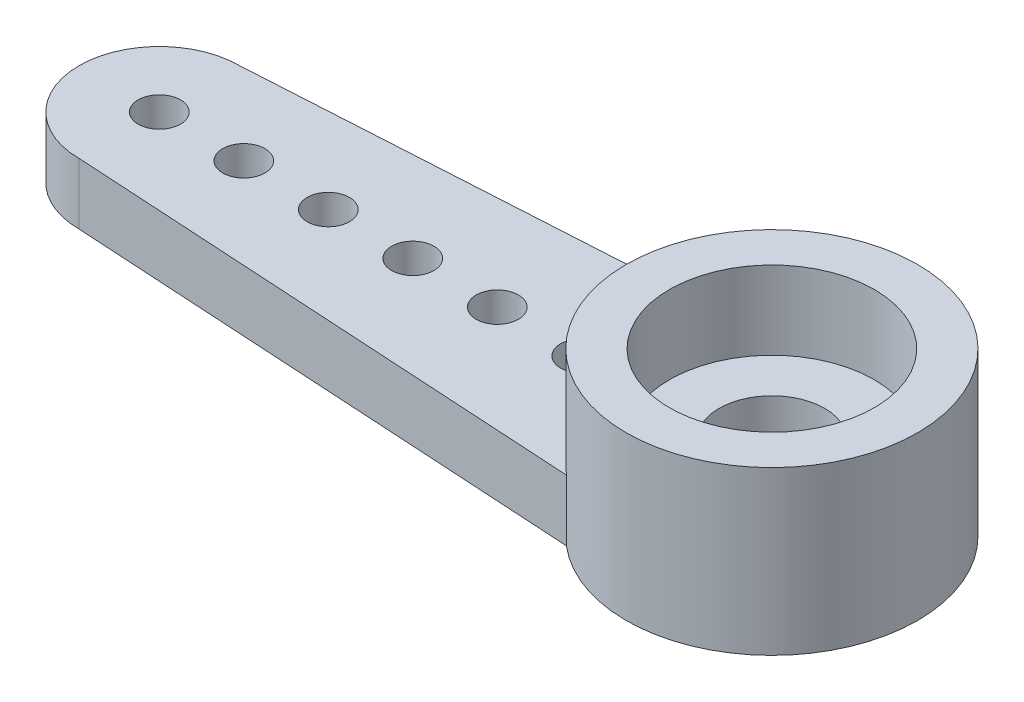
from build123d import *

# Parameters (mm, degrees)
SKETCH_1_R      = 3.45
SKETCH_1_R_2    = 2.425
EXTRUDE_1_DEPTH = 3.85
SKETCH_2_R      = 2.425
SKETCH_2_R_2    = 1.25
EXTRUDE_2_DEPTH = 1
SKETCH_3_R      = 0.5
EXTRUDE_3_DEPTH = 1.45


with BuildPart() as part:
    # 草图1 → 凸台-拉伸1 (new body)
    with BuildSketch(Plane(origin=(0, 0, 0), x_dir=(1, 0, 0), z_dir=(0, 1, 0))):
        with Locations(Location((0, 0, 0), (0, 0, 90))):
            Circle(SKETCH_1_R)
        with Locations(Location((0, 0, 0), (0, 0, 90))):
            Circle(SKETCH_1_R_2, mode=Mode.SUBTRACT)
    extrude(amount=EXTRUDE_1_DEPTH)

    # 草图2 → 凸台-拉伸2 (add)
    with BuildSketch(Plane(origin=(0, 1, 0), x_dir=(-1, 0, 0), z_dir=(0, -1, 0))):
        with Locations(Location((0, 0, 0), (0, 0, 90))):
            Circle(SKETCH_2_R)
        with Locations(Location((0, 0, 0), (0, 0, 90))):
            Circle(SKETCH_2_R_2, mode=Mode.SUBTRACT)
    extrude(amount=-EXTRUDE_2_DEPTH)

    # 草图3 → 凸台-拉伸3 (add)
    with BuildSketch(Plane.XZ):
        with BuildLine():
            Line((-14.5, -1.9), (-2.238721733, -2.625))
            ThreePointArc((-2.238721733, -2.625), (-3.45, 0), (-2.238721733, 2.625))
            Line((-2.238721733, 2.625), (-14.5, 1.9))
            ThreePointArc((-14.5, 1.9), (-16.4, 0), (-14.5, -1.9))
        make_face()
        with Locations(Location((-14.5, 0, 0), (0, 0, 270))):
            Circle(SKETCH_3_R, mode=Mode.SUBTRACT)
        with Locations(Location((-12.5, 0, 0), (0, 0, 270))):
            Circle(SKETCH_3_R, mode=Mode.SUBTRACT)
        with Locations(Location((-10.5, 0, 0), (0, 0, 270))):
            Circle(SKETCH_3_R, mode=Mode.SUBTRACT)
        with Locations(Location((-8.5, 0, 0), (0, 0, 270))):
            Circle(SKETCH_3_R, mode=Mode.SUBTRACT)
        with Locations(Location((-6.5, 0, 0), (0, 0, 270))):
            Circle(SKETCH_3_R, mode=Mode.SUBTRACT)
        with Locations(Location((-4.5, 0, 0), (0, 0, 270))):
            Circle(SKETCH_3_R, mode=Mode.SUBTRACT)
    extrude(amount=-EXTRUDE_3_DEPTH)


solid = part.part
